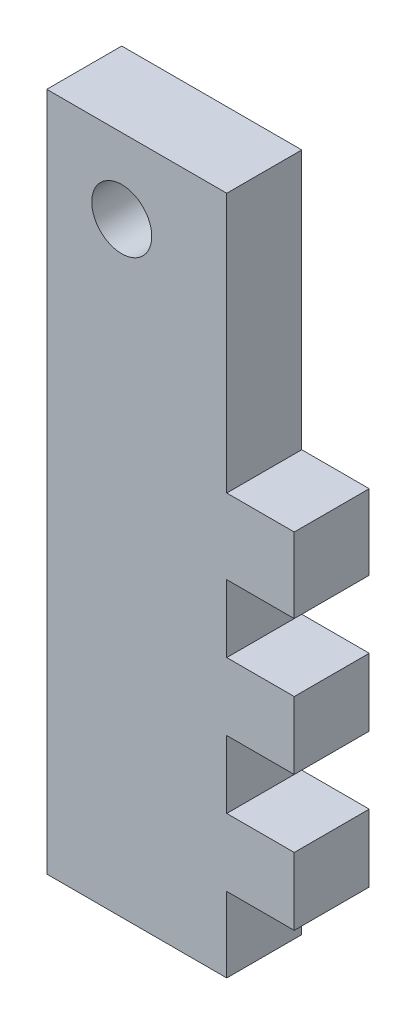
from build123d import *

# Parameters (mm, degrees)
ESQUISSE1_R        = 2
BOSS_EXTRU_1_DEPTH = 5


with BuildPart() as part:
    # Esquisse1 → Boss.-Extru.1 (new body)
    with BuildSketch(Plane.XY):
        Polygon((11.2977547, 0.845653602), (11.2977547, 5.845653602), (11.2977547, 18.155101602), (-0.7022453, 18.155101602), (-0.7022453, 5.845653602), (-0.7022453, -27.154346398), (11.2977547, -27.154346398), (11.2977547, -22.154346398), (15.7977527, -22.154346398), (15.7977527, -17.654346398), (11.2977547, -17.654346398), (11.2977547, -13.154346398), (15.7977527, -13.154346398), (15.7977527, -8.654346398), (11.2977547, -8.654346398), (11.2977547, -4.154346398), (15.7977527, -4.154346398), (15.7977527, 0.845653602), align=None)
        with Locations((4.2977547, 13.158702602)):
            Circle(ESQUISSE1_R, mode=Mode.SUBTRACT)
    extrude(amount=BOSS_EXTRU_1_DEPTH)


solid = part.part
